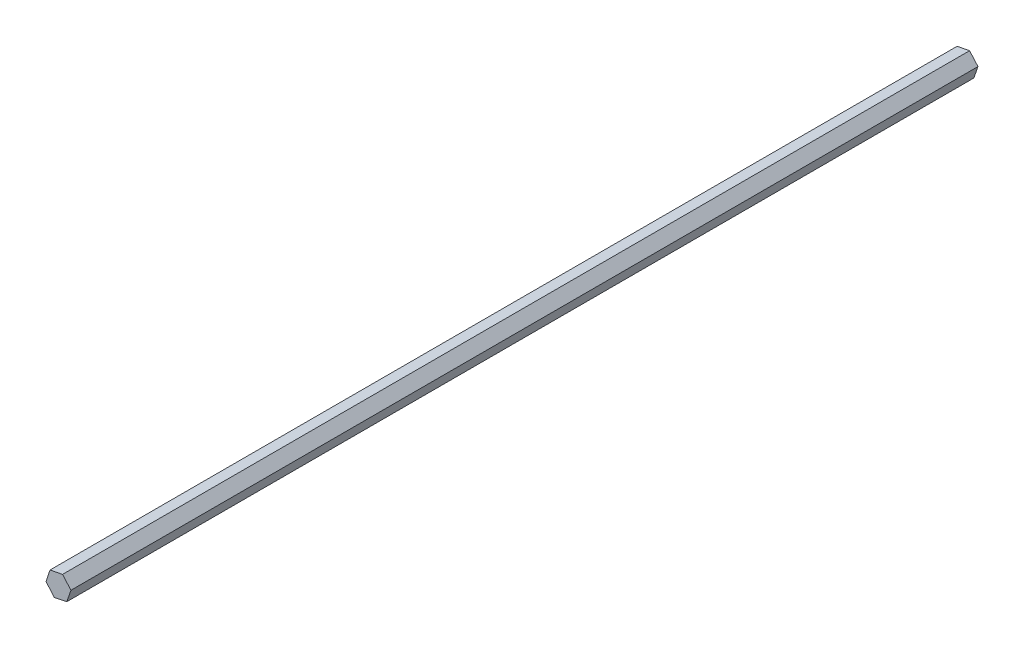
from build123d import *

# Parameters (mm, degrees)
BOSS_EXTRUDE1_DEPTH = 523.24


with BuildPart() as part:
    # Sketch1 → Boss-Extrude1 (new body)
    with BuildSketch(Plane(origin=(0, 0, -228.6), x_dir=(-1, 0, 0), z_dir=(0, 0, -1))):
        Polygon((-2.35748511, 6.924711439), (-7.209939519, 1.427489097), (-4.818233465, -5.503997714), (2.368727938, -6.957735332), (7.175718575, -1.420713725), (4.841211581, 5.530246234), align=None)
    extrude(amount=-BOSS_EXTRUDE1_DEPTH)


solid = part.part
